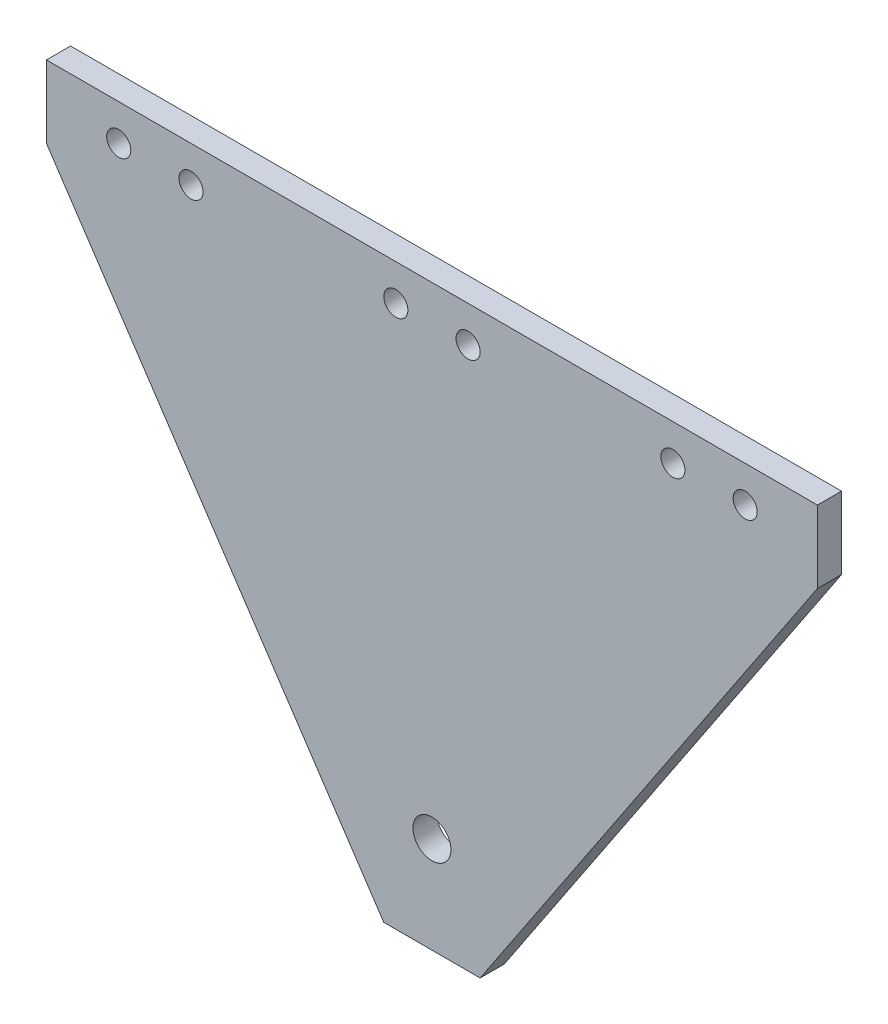
from build123d import *

# Parameters (mm, degrees)
SKETCH1_R           = 1.5875
SKETCH1_R_2         = 2.50000008
BOSS_EXTRUDE1_DEPTH = 3.175


with BuildPart() as part:
    # Sketch1 → Boss-Extrude1 (new body)
    with BuildSketch(Plane.XY):
        Polygon((-50.8, -4.7625), (-50.8, 4.7625), (50.8, 4.7625), (50.8, -4.7625), (6.35, -71.4375), (-6.35, -71.4375), align=None)
        with Locations((4.7625, 0)):
            Circle(SKETCH1_R, mode=Mode.SUBTRACT)
        with Locations((-4.7625, 0)):
            Circle(SKETCH1_R, mode=Mode.SUBTRACT)
        with Locations((-41.275, 0)):
            Circle(SKETCH1_R, mode=Mode.SUBTRACT)
        with Locations((-31.75, 0)):
            Circle(SKETCH1_R, mode=Mode.SUBTRACT)
        with Locations((31.75, 0)):
            Circle(SKETCH1_R, mode=Mode.SUBTRACT)
        with Locations((41.275, 0)):
            Circle(SKETCH1_R, mode=Mode.SUBTRACT)
        with Locations((0, -58.7375)):
            Circle(SKETCH1_R_2, mode=Mode.SUBTRACT)
    extrude(amount=BOSS_EXTRUDE1_DEPTH)


solid = part.part
